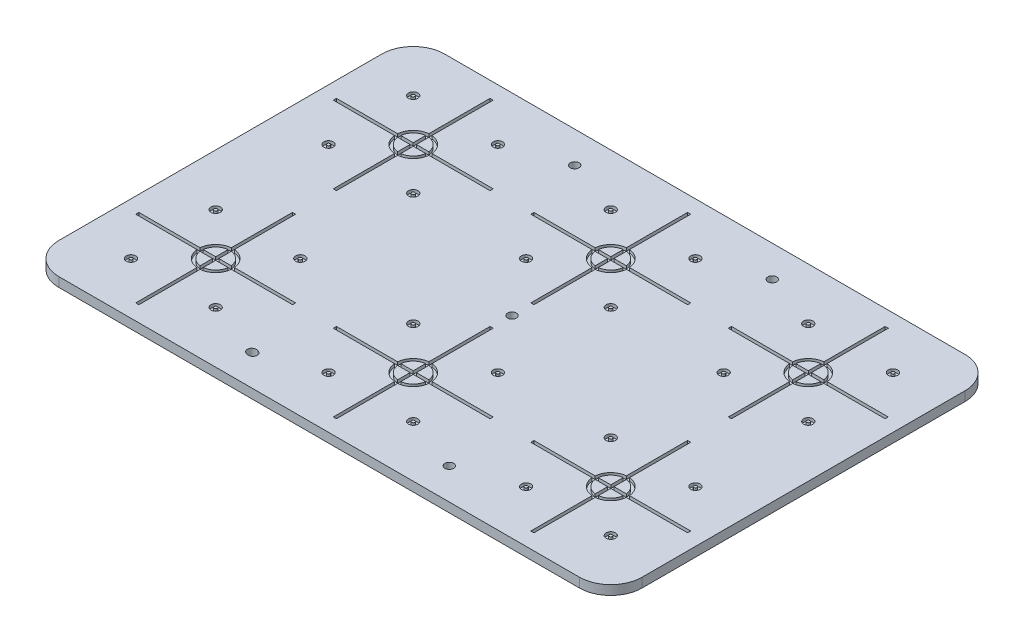
from build123d import *

# Parameters (mm, degrees)
BOSS_EXTRUDE1_DEPTH     = 3
SKETCH2_R               = 1.5
SKETCH2_R_2             = 0.5
SKETCH2_R_3             = 5.5
SKETCH2_R_4             = 4.5
SKETCH2_W               = 50
SKETCH2_H               = 1
SKETCH2_W_2             = 1
SKETCH2_H_2             = 50
CUT_EXTRUDE_THIN1_DEPTH = 1
LPATTERN1_COUNT         = 3
LPATTERN1_PITCH         = 63
LPATTERN1_COUNT_DIR2    = 2
LPATTERN1_PITCH_DIR2    = 63
F_3_CLEARANCE_HOLE2_D   = 2.794


with BuildPart() as part:
    # Sketch1 → Boss-Extrude1 (new body)
    with BuildSketch(Plane(origin=(0, 0, 0), x_dir=(1, 0, 0), z_dir=(0, 1, 0))):
        with BuildLine():
            Line((83, 61.5), (-83, 61.5))
            ThreePointArc((-83, 61.5), (-90.071067812, 58.571067812), (-93, 51.5))
            Line((-93, 51.5), (-93, -51.5))
            ThreePointArc((-93, -51.5), (-90.071067812, -58.571067812), (-83, -61.5))
            Line((-83, -61.5), (83, -61.5))
            ThreePointArc((83, -61.5), (90.071067812, -58.571067812), (93, -51.5))
            Line((93, -51.5), (93, 51.5))
            ThreePointArc((93, 51.5), (90.071067812, 58.571067812), (83, 61.5))
        make_face()
    extrude(amount=BOSS_EXTRUDE1_DEPTH)

    # Sketch2 → Cut-Extrude-Thin1 (cut)
    # profile 1 of 7: a face of its own
    with BuildSketch(Plane(origin=(0, 3, 0), x_dir=(1, 0, 0), z_dir=(0, 1, 0))):
        with Locations((-76.5, 45)):
            Circle(SKETCH2_R)
        with Locations((-76.5, 45)):
            Circle(SKETCH2_R_2, mode=Mode.SUBTRACT)
    # profile 2 of 7: a face of its own
    with BuildSketch(Plane(origin=(0, 3, 0), x_dir=(1, 0, 0), z_dir=(0, 1, 0))):
        with Locations((-49.5, 45)):
            Circle(SKETCH2_R)
        with Locations((-49.5, 45)):
            Circle(SKETCH2_R_2, mode=Mode.SUBTRACT)
    # profile 3 of 7: a face of its own
    with BuildSketch(Plane(origin=(0, 3, 0), x_dir=(1, 0, 0), z_dir=(0, 1, 0))):
        with Locations((-63, 31.5)):
            Circle(SKETCH2_R_3)
        with Locations((-63, 31.5)):
            Circle(SKETCH2_R_4, mode=Mode.SUBTRACT)
    # profile 4 of 7: a face of its own
    with BuildSketch(Plane(origin=(0, 3, 0), x_dir=(1, 0, 0), z_dir=(0, 1, 0))):
        with Locations((-49.5, 18)):
            Circle(SKETCH2_R)
        with Locations((-49.5, 18)):
            Circle(SKETCH2_R_2, mode=Mode.SUBTRACT)
    # profile 5 of 7: a face of its own
    with BuildSketch(Plane(origin=(0, 3, 0), x_dir=(1, 0, 0), z_dir=(0, 1, 0))):
        with Locations((-76.5, 18)):
            Circle(SKETCH2_R)
        with Locations((-76.5, 18)):
            Circle(SKETCH2_R_2, mode=Mode.SUBTRACT)
    # profile 6 of 7: a face of its own
    with BuildSketch(Plane(origin=(0, 3, 0), x_dir=(1, 0, 0), z_dir=(0, 1, 0))):
        with Locations((-63, 31.5)):
            Rectangle(SKETCH2_W, SKETCH2_H)
    # profile 7 of 7: a face of its own
    with BuildSketch(Plane(origin=(0, 3, 0), x_dir=(1, 0, 0), z_dir=(0, 1, 0))):
        with Locations((-63, 31.5)):
            Rectangle(SKETCH2_W_2, SKETCH2_H_2)
    cut_extrude_thin1 = extrude(amount=-CUT_EXTRUDE_THIN1_DEPTH, mode=Mode.SUBTRACT)

    # LPattern1: Cut-Extrude-Thin1 3 × 2
    with Locations(*[(i * LPATTERN1_PITCH, 0, j * LPATTERN1_PITCH_DIR2) for i in range(LPATTERN1_COUNT) for j in range(LPATTERN1_COUNT_DIR2) if (i, j) != (0, 0)]):
        add(cut_extrude_thin1, mode=Mode.SUBTRACT)

    # #3 Clearance Hole2 (through all)
    with Locations(Plane(origin=(0, 3, 0), x_dir=(1, 0, 0), z_dir=(0, 1, 0))):
        with Locations((-31.5, 51.5), (31.5, 51.5), (31.5, -51.5), (-31.5, -51.5), (-31.036950727, -51.615798491), (0, 0)):
            Hole(F_3_CLEARANCE_HOLE2_D / 2)


solid = part.part
